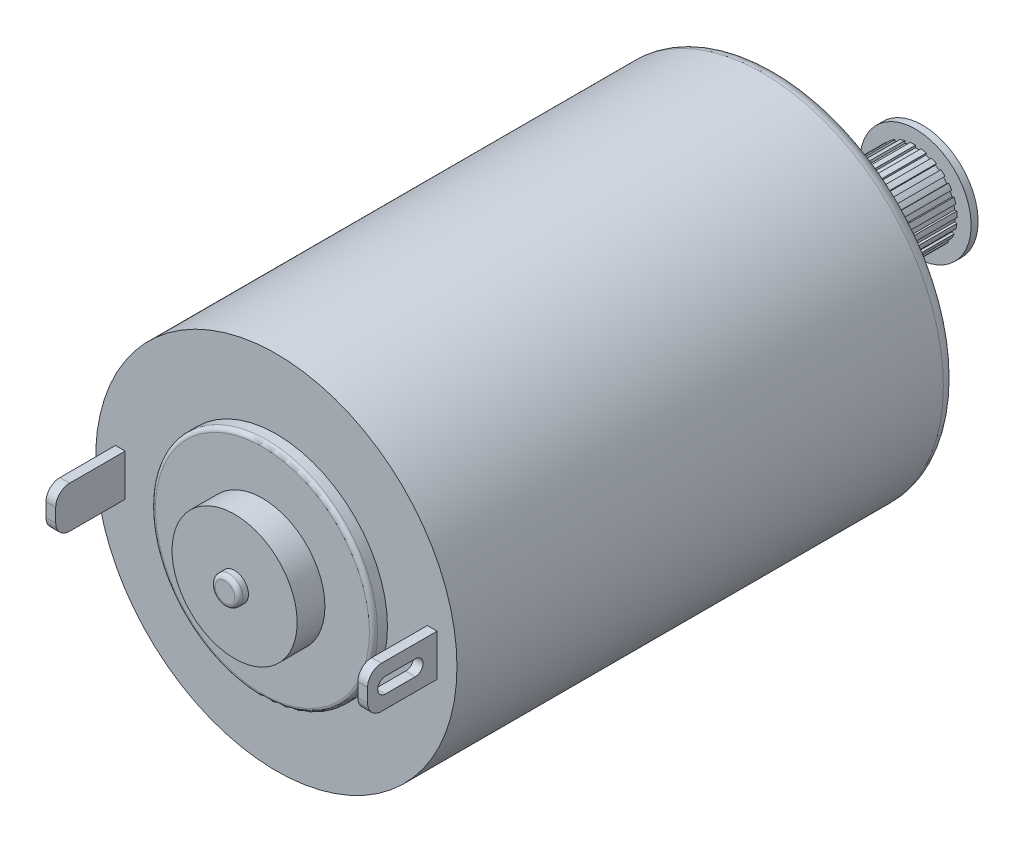
from build123d import *

# Parameters (mm, degrees)
SKETCH1_R           = 13
BOSS_EXTRUDE1_DEPTH = 36
SKETCH2_R           = 8
BOSS_EXTRUDE2_DEPTH = 1
SKETCH3_R           = 4.5
BOSS_EXTRUDE3_DEPTH = 2
SKETCH4_R           = 1
BOSS_EXTRUDE4_DEPTH = 0.7
FILLET1_R           = 0.3
FILLET2_R           = 0.3
SKETCH5_W           = 0.7
SKETCH5_H           = 3
BOSS_EXTRUDE5_DEPTH = 5
FILLET3_R           = 1
FILLET4_R           = 1
CUT_EXTRUDE1_DEPTH  = 5
BOSS_EXTRUDE6_START = 2
SKETCH8_R           = 4.5
BOSS_EXTRUDE6_DEPTH = 2
BOSS_EXTRUDE7_START = 2
SKETCH9_R           = 1
BOSS_EXTRUDE7_DEPTH = 2
SKETCH10_R          = 3
BOSS_EXTRUDE8_DEPTH = 6
CUT_EXTRUDE2_DEPTH  = 8
SKETCH12_R          = 4
BOSS_EXTRUDE9_DEPTH = 0.5
SKETCH13_R          = 1
CUT_EXTRUDE3_DEPTH  = 1
FILLET5_R           = 1


with BuildPart() as part:
    # Sketch1 → Boss-Extrude1 (new body)
    with BuildSketch(Plane.XY):
        Circle(SKETCH1_R)
    extrude(amount=BOSS_EXTRUDE1_DEPTH)

    # Sketch2 → Boss-Extrude2 (add)
    with BuildSketch(Plane.XY.offset(36)):
        Circle(SKETCH2_R)
    extrude(amount=BOSS_EXTRUDE2_DEPTH)

    # Sketch3 → Boss-Extrude3 (add)
    with BuildSketch(Plane.XY.offset(37)):
        Circle(SKETCH3_R)
    extrude(amount=BOSS_EXTRUDE3_DEPTH)

    # Sketch4 → Boss-Extrude4 (add)
    with BuildSketch(Plane.XY.offset(39)):
        Circle(SKETCH4_R)
    extrude(amount=BOSS_EXTRUDE4_DEPTH)

    # Fillet1
    fillet1_edges = [part.edges().sort_by_distance(p)[0] for p in [
        (-1, 0, 39.7),
    ]]
    fillet(fillet1_edges, radius=FILLET1_R)

    # Fillet2
    fillet2_edges = [part.edges().sort_by_distance(p)[0] for p in [
        (-8, 0, 37),
    ]]
    fillet(fillet2_edges, radius=FILLET2_R)

    # Sketch5 → Boss-Extrude5 (add)
    with BuildSketch(Plane.XY.offset(36)):
        with Locations((-11.220982421, 0)):
            Rectangle(SKETCH5_W, SKETCH5_H)
        with Locations((11.220982421, 0)):
            Rectangle(SKETCH5_W, SKETCH5_H)
    extrude(amount=BOSS_EXTRUDE5_DEPTH)

    # Fillet3
    fillet3_edges = [part.edges().sort_by_distance(p)[0] for p in [
        (11.220982421, -1.5, 41),
        (11.220982421, 1.5, 41),
    ]]
    fillet(fillet3_edges, radius=FILLET3_R)

    # Fillet4
    fillet4_edges = [part.edges().sort_by_distance(p)[0] for p in [
        (-11.220982421, 1.5, 41),
        (-11.220982421, -1.5, 41),
    ]]
    fillet(fillet4_edges, radius=FILLET4_R)

    # Sketch7 → Cut-Extrude1 (cut)
    with BuildSketch(Plane(origin=(11.570982421, 0, 0), x_dir=(0, 0, -1), z_dir=(1, 0, 0))):
        with BuildLine():
            Line((-37.568828758, -0.556582473), (-39.717079544, -0.556582473))
            ThreePointArc((-39.717079544, -0.556582473), (-40.273662016, 0), (-39.717079544, 0.556582473))
            Line((-39.717079544, 0.556582473), (-37.568828758, 0.556582473))
            ThreePointArc((-37.568828758, 0.556582473), (-37.012246285, 0), (-37.568828758, -0.556582473))
        make_face()
    extrude(amount=-CUT_EXTRUDE1_DEPTH, mode=Mode.SUBTRACT)

    # Sketch8 → Boss-Extrude6 (add)
    with BuildSketch(Plane(origin=(0, 0, 0), x_dir=(-1, 0, 0), z_dir=(0, 0, -1)).offset(BOSS_EXTRUDE6_START)):
        with Locations(Location((0, 0, 0), (0, 0, 180))):
            Circle(SKETCH8_R)
    extrude(amount=-BOSS_EXTRUDE6_DEPTH)

    # Sketch9 → Boss-Extrude7 (add)
    with BuildSketch(Plane(origin=(0, 0, -2), x_dir=(-1, 0, 0), z_dir=(0, 0, -1)).offset(BOSS_EXTRUDE7_START)):
        with Locations(Location((0, 0, 0), (0, 0, 180))):
            Circle(SKETCH9_R)
    extrude(amount=-BOSS_EXTRUDE7_DEPTH)

    # Sketch10 → Boss-Extrude8 (add)
    with BuildSketch(Plane(origin=(0, 0, -4), x_dir=(-1, 0, 0), z_dir=(0, 0, -1))):
        Circle(SKETCH10_R)
    extrude(amount=BOSS_EXTRUDE8_DEPTH)

    # Sketch11 → Cut-Extrude2 (cut)
    with BuildSketch(Plane(origin=(0, 0, -10), x_dir=(-1, 0, 0), z_dir=(0, 0, -1))):
        with BuildLine():
            Line((0, 3.035809854), (0, 2.842678039))
            ThreePointArc((0, 2.842678039), (-0.185920039, 2.836591647), (-0.37104394, 2.818358534))
            Line((-0.37104394, 2.818358534), (-0.408370483, 3.101881777))
            Line((-0.408370483, 3.101881777), (0, 3.035809854))
        make_face()
        with BuildLine():
            Line((0.785725408, 2.932367142), (0.735739216, 2.745816134))
            ThreePointArc((0.735739216, 2.745816134), (0.554578974, 2.788056778), (0.37104394, 2.818358534))
            Line((0.37104394, 2.818358534), (0.408370483, 3.101881777))
            Line((0.408370483, 3.101881777), (0.785725408, 2.932367142))
        make_face()
        with BuildLine():
            Line((1.517904927, 2.629088455), (1.42133902, 2.461831397))
            ThreePointArc((1.42133902, 2.461831397), (1.257284347, 2.549520446), (1.087845789, 2.626292058))
            Line((1.087845789, 2.626292058), (1.197281676, 2.89049366))
            Line((1.197281676, 2.89049366), (1.517904927, 2.629088455))
        make_face()
        with BuildLine():
            Line((2.146641734, 2.146641734), (2.010076918, 2.010076918))
            ThreePointArc((2.010076918, 2.010076918), (1.874307869, 2.13723851), (1.730512745, 2.255248118))
            Line((1.730512745, 2.255248118), (1.904600101, 2.482123177))
            Line((1.904600101, 2.482123177), (2.146641734, 2.146641734))
        make_face()
        with BuildLine():
            Line((2.629088455, 1.517904927), (2.461831397, 1.42133902))
            ThreePointArc((2.461831397, 1.42133902), (2.363600407, 1.579307301), (2.255248118, 1.730512745))
            Line((2.255248118, 1.730512745), (2.482123177, 1.904600101))
            Line((2.482123177, 1.904600101), (2.629088455, 1.517904927))
        make_face()
        with BuildLine():
            Line((2.932367142, 0.785725408), (2.745816134, 0.735739216))
            ThreePointArc((2.745816134, 0.735739216), (2.691817484, 0.913748909), (2.626292058, 1.087845789))
            Line((2.626292058, 1.087845789), (2.89049366, 1.197281676))
            Line((2.89049366, 1.197281676), (2.932367142, 0.785725408))
        make_face()
        with BuildLine():
            Line((3.035809854, 0), (2.842678039, 0))
            ThreePointArc((2.842678039, 0), (2.836591647, 0.185920039), (2.818358534, 0.37104394))
            Line((2.818358534, 0.37104394), (3.101881777, 0.408370483))
            Line((3.101881777, 0.408370483), (3.035809854, 0))
        make_face()
        with BuildLine():
            Line((2.932367142, -0.785725408), (2.745816134, -0.735739216))
            ThreePointArc((2.745816134, -0.735739216), (2.788056778, -0.554578974), (2.818358534, -0.37104394))
            Line((2.818358534, -0.37104394), (3.101881777, -0.408370483))
            Line((3.101881777, -0.408370483), (2.932367142, -0.785725408))
        make_face()
        with BuildLine():
            Line((2.629088455, -1.517904927), (2.461831397, -1.42133902))
            ThreePointArc((2.461831397, -1.42133902), (2.549520446, -1.257284347), (2.626292058, -1.087845789))
            Line((2.626292058, -1.087845789), (2.89049366, -1.197281676))
            Line((2.89049366, -1.197281676), (2.629088455, -1.517904927))
        make_face()
        with BuildLine():
            Line((2.146641734, -2.146641734), (2.010076918, -2.010076918))
            ThreePointArc((2.010076918, -2.010076918), (2.13723851, -1.874307869), (2.255248118, -1.730512745))
            Line((2.255248118, -1.730512745), (2.482123177, -1.904600101))
            Line((2.482123177, -1.904600101), (2.146641734, -2.146641734))
        make_face()
        with BuildLine():
            Line((1.517904927, -2.629088455), (1.42133902, -2.461831397))
            ThreePointArc((1.42133902, -2.461831397), (1.579307301, -2.363600407), (1.730512745, -2.255248118))
            Line((1.730512745, -2.255248118), (1.904600101, -2.482123177))
            Line((1.904600101, -2.482123177), (1.517904927, -2.629088455))
        make_face()
        with BuildLine():
            Line((0.785725408, -2.932367142), (0.735739216, -2.745816134))
            ThreePointArc((0.735739216, -2.745816134), (0.913748909, -2.691817484), (1.087845789, -2.626292058))
            Line((1.087845789, -2.626292058), (1.197281676, -2.89049366))
            Line((1.197281676, -2.89049366), (0.785725408, -2.932367142))
        make_face()
        with BuildLine():
            Line((0, -3.035809854), (0, -2.842678039))
            ThreePointArc((0, -2.842678039), (0.185920039, -2.836591647), (0.37104394, -2.818358534))
            Line((0.37104394, -2.818358534), (0.408370483, -3.101881777))
            Line((0.408370483, -3.101881777), (0, -3.035809854))
        make_face()
        with BuildLine():
            Line((-0.785725408, -2.932367142), (-0.735739216, -2.745816134))
            ThreePointArc((-0.735739216, -2.745816134), (-0.554578974, -2.788056778), (-0.37104394, -2.818358534))
            Line((-0.37104394, -2.818358534), (-0.408370483, -3.101881777))
            Line((-0.408370483, -3.101881777), (-0.785725408, -2.932367142))
        make_face()
        with BuildLine():
            Line((-1.517904927, -2.629088455), (-1.42133902, -2.461831397))
            ThreePointArc((-1.42133902, -2.461831397), (-1.257284347, -2.549520446), (-1.087845789, -2.626292058))
            Line((-1.087845789, -2.626292058), (-1.197281676, -2.89049366))
            Line((-1.197281676, -2.89049366), (-1.517904927, -2.629088455))
        make_face()
        with BuildLine():
            Line((-2.146641734, -2.146641734), (-2.010076918, -2.010076918))
            ThreePointArc((-2.010076918, -2.010076918), (-1.874307869, -2.13723851), (-1.730512745, -2.255248118))
            Line((-1.730512745, -2.255248118), (-1.904600101, -2.482123177))
            Line((-1.904600101, -2.482123177), (-2.146641734, -2.146641734))
        make_face()
        with BuildLine():
            Line((-2.629088455, -1.517904927), (-2.461831397, -1.42133902))
            ThreePointArc((-2.461831397, -1.42133902), (-2.363600407, -1.579307301), (-2.255248118, -1.730512745))
            Line((-2.255248118, -1.730512745), (-2.482123177, -1.904600101))
            Line((-2.482123177, -1.904600101), (-2.629088455, -1.517904927))
        make_face()
        with BuildLine():
            Line((-2.932367142, -0.785725408), (-2.745816134, -0.735739216))
            ThreePointArc((-2.745816134, -0.735739216), (-2.691817484, -0.913748909), (-2.626292058, -1.087845789))
            Line((-2.626292058, -1.087845789), (-2.89049366, -1.197281676))
            Line((-2.89049366, -1.197281676), (-2.932367142, -0.785725408))
        make_face()
        with BuildLine():
            Line((-3.035809854, 0), (-2.842678039, 0))
            ThreePointArc((-2.842678039, 0), (-2.836591647, -0.185920039), (-2.818358534, -0.37104394))
            Line((-2.818358534, -0.37104394), (-3.101881777, -0.408370483))
            Line((-3.101881777, -0.408370483), (-3.035809854, 0))
        make_face()
        with BuildLine():
            Line((-2.932367142, 0.785725408), (-2.745816134, 0.735739216))
            ThreePointArc((-2.745816134, 0.735739216), (-2.788056778, 0.554578974), (-2.818358534, 0.37104394))
            Line((-2.818358534, 0.37104394), (-3.101881777, 0.408370483))
            Line((-3.101881777, 0.408370483), (-2.932367142, 0.785725408))
        make_face()
        with BuildLine():
            Line((-2.629088455, 1.517904927), (-2.461831397, 1.42133902))
            ThreePointArc((-2.461831397, 1.42133902), (-2.549520446, 1.257284347), (-2.626292058, 1.087845789))
            Line((-2.626292058, 1.087845789), (-2.89049366, 1.197281676))
            Line((-2.89049366, 1.197281676), (-2.629088455, 1.517904927))
        make_face()
        with BuildLine():
            Line((-2.146641734, 2.146641734), (-2.010076918, 2.010076918))
            ThreePointArc((-2.010076918, 2.010076918), (-2.13723851, 1.874307869), (-2.255248118, 1.730512745))
            Line((-2.255248118, 1.730512745), (-2.482123177, 1.904600101))
            Line((-2.482123177, 1.904600101), (-2.146641734, 2.146641734))
        make_face()
        with BuildLine():
            Line((-1.517904927, 2.629088455), (-1.42133902, 2.461831397))
            ThreePointArc((-1.42133902, 2.461831397), (-1.579307301, 2.363600407), (-1.730512745, 2.255248118))
            Line((-1.730512745, 2.255248118), (-1.904600101, 2.482123177))
            Line((-1.904600101, 2.482123177), (-1.517904927, 2.629088455))
        make_face()
        with BuildLine():
            Line((-0.785725408, 2.932367142), (-0.735739216, 2.745816134))
            ThreePointArc((-0.735739216, 2.745816134), (-0.913748909, 2.691817484), (-1.087845789, 2.626292058))
            Line((-1.087845789, 2.626292058), (-1.197281676, 2.89049366))
            Line((-1.197281676, 2.89049366), (-0.785725408, 2.932367142))
        make_face()
    extrude(amount=-CUT_EXTRUDE2_DEPTH, mode=Mode.SUBTRACT)

    # Sketch12 → Boss-Extrude9 (add)
    with BuildSketch(Plane(origin=(0, 0, -10), x_dir=(-1, 0, 0), z_dir=(0, 0, -1))):
        Circle(SKETCH12_R)
    extrude(amount=BOSS_EXTRUDE9_DEPTH)

    # Sketch13 → Cut-Extrude3 (cut)
    with BuildSketch(Plane(origin=(0, 0, -10.5), x_dir=(-1, 0, 0), z_dir=(0, 0, -1))):
        with Locations(Location((0, 0, 0), (0, 0, 180))):
            Circle(SKETCH13_R)
    extrude(amount=-CUT_EXTRUDE3_DEPTH, mode=Mode.SUBTRACT)

    # Fillet5
    fillet5_edges = [part.edges().sort_by_distance(p)[0] for p in [
        (-13, 0, 0),
    ]]
    fillet(fillet5_edges, radius=FILLET5_R)


solid = part.part
